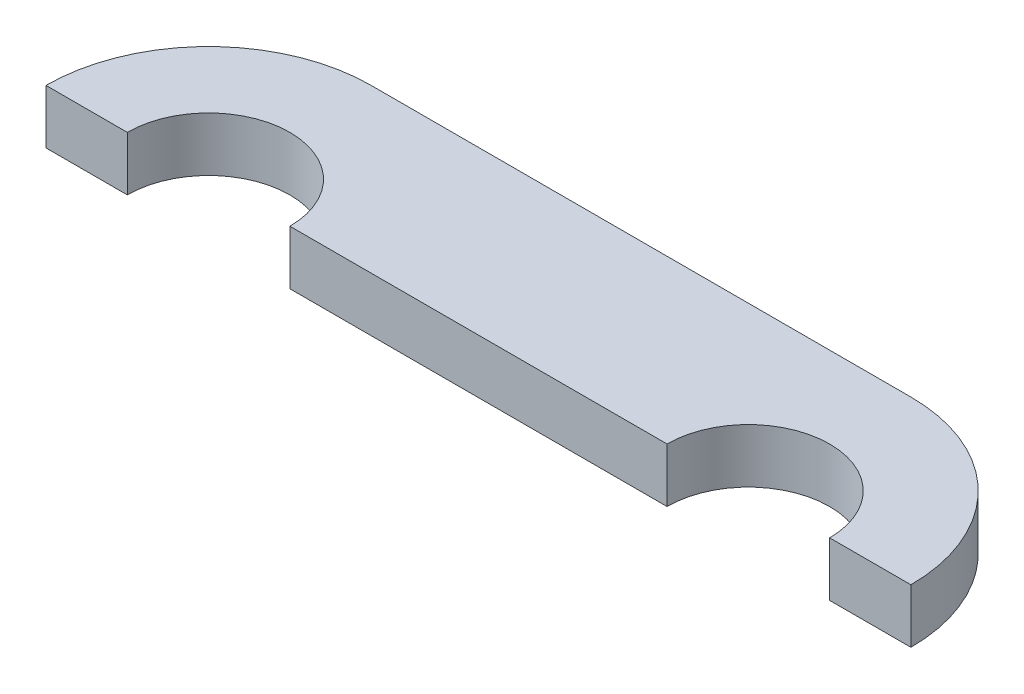
from build123d import *

# Parameters (mm, degrees)
SKETCH1_R               = 2.38125
BOSS_EXTRUDE1_DEPTH     = 1.5875
SKETCH2_R               = 3.175
BOSS_EXTRUDE2_DEPTH     = 1.5875
SKETCH3_R               = 2.38125
BOSS_EXTRUDE3_DEPTH     = 19.05
SKETCH4_R               = 3.175
BOSS_EXTRUDE4_DEPTH     = 1.5875
SKETCH5_R               = 2.38125
BOSS_EXTRUDE5_DEPTH     = 1.5875
SKETCH6_R               = 2.38125
CUT_EXTRUDE1_DEPTH      = 28.662025878
SKETCH7_W               = 40.69090725
SKETCH7_H               = 20.005301762
CUT_EXTRUDE2_DEPTH      = 26.381492779
CUT_EXTRUDE3_DEPTH      = 19.487872394
CUT_EXTRUDE3_DEPTH_BACK = 19.487872394
SKETCH8_R               = 2.38125


with BuildPart() as part:
    # Sketch1 → Boss-Extrude1 (new body)
    with BuildSketch(Plane(origin=(0, 0, 0), x_dir=(1, 0, 0), z_dir=(0, 1, 0))):
        with BuildLine():
            Line((9.398005644, 4.762076723), (-6.35, 4.7625))
            ThreePointArc((-6.35, 4.7625), (-11.020584629, 0.931152767), (-8.176363381, -4.398386414))
            ThreePointArc((-8.176363381, -4.398386414), (-5.292234705, -6.221263486), (-3.181508348, -8.901918869))
            ThreePointArc((-3.181508348, -8.901918869), (1.849687492, -11.693035316), (6.504625866, -8.311495529))
            ThreePointArc((6.504625866, -8.311495529), (8.146827792, -5.96033805), (10.67447942, -4.60544104))
            ThreePointArc((10.67447942, -4.60544104), (14.180390361, 0.643024113), (9.398005644, 4.762076723))
        make_face()
        with Locations(Location((-6.35, 0, 0), (0, 0, 270))):
            Circle(SKETCH1_R, mode=Mode.SUBTRACT)
        with Locations(Location((9.4615, 0, 0), (0, 0, 270))):
            Circle(SKETCH1_R, mode=Mode.SUBTRACT)
        with Locations(Location((1.524, -6.35, 0), (0, 0, 270))):
            Circle(SKETCH1_R, mode=Mode.SUBTRACT)
    extrude(amount=BOSS_EXTRUDE1_DEPTH)

    # Sketch2 → Boss-Extrude2 (add)
    with BuildSketch(Plane.XZ):
        with Locations(Location((1.524, 6.35, 0), (0, 0, 90))):
            Circle(SKETCH2_R)
    extrude(amount=BOSS_EXTRUDE2_DEPTH)

    # Sketch3 → Boss-Extrude3 (add)
    with BuildSketch(Plane(origin=(0, 0, 0), x_dir=(1, 0, 0), z_dir=(0, 1, 0))):
        with Locations(Location((1.524, -6.35, 0), (0, 0, 90))):
            Circle(SKETCH3_R)
    extrude(amount=BOSS_EXTRUDE3_DEPTH)

    # Sketch4 → Boss-Extrude4 (add)
    with BuildSketch(Plane(origin=(0, 19.05, 0), x_dir=(1, 0, 0), z_dir=(0, 1, 0))):
        with Locations(Location((1.524, -6.35, 0), (0, 0, 270))):
            Circle(SKETCH4_R)
    extrude(amount=-BOSS_EXTRUDE4_DEPTH)

    # Sketch6 → Cut-Extrude1 (cut, through all)
    with BuildSketch(Plane(origin=(0, 19.05, 0), x_dir=(1, 0, 0), z_dir=(0, 1, 0))):
        with Locations(Location((1.524, -6.35, 0), (0, 0, 90))):
            Circle(SKETCH6_R)
    extrude(amount=-CUT_EXTRUDE1_DEPTH, mode=Mode.SUBTRACT)


with BuildPart() as body_2:
    # Sketch5 → Boss-Extrude5 (new body)
    with BuildSketch(Plane.XZ.offset(-17.4625)):
        with BuildLine():
            ThreePointArc((-8.176363381, 4.398386414), (-11.020584629, -0.931152767), (-6.35, -4.7625))
            Line((-6.35, -4.7625), (9.4615, -4.7625))
            ThreePointArc((9.4615, -4.7625), (14.184572051, -0.611552653), (10.67447942, 4.60544104))
            ThreePointArc((10.67447942, 4.60544104), (8.146827792, 5.96033805), (6.504625866, 8.311495529))
            ThreePointArc((6.504625866, 8.311495529), (1.849687492, 11.693035316), (-3.181508348, 8.901918869))
            ThreePointArc((-3.181508348, 8.901918869), (-5.292234705, 6.221263486), (-8.176363381, 4.398386414))
        make_face()
        with Locations(Location((-6.35, 0, 0), (0, 0, 270))):
            Circle(SKETCH5_R, mode=Mode.SUBTRACT)
        with Locations(Location((9.4615, 0, 0), (0, 0, 270))):
            Circle(SKETCH5_R, mode=Mode.SUBTRACT)
        with Locations(Location((1.524, 6.35, 0), (0, 0, 270))):
            Circle(SKETCH5_R, mode=Mode.SUBTRACT)
    extrude(amount=BOSS_EXTRUDE5_DEPTH)


with BuildPart() as cut_extrude1_piece_1:
    # of the separate pieces the step leaves, piece 1, a body of its own (cut_extrude1_pieces)
    add(part.part.solids().sort_by_distance((9.398005644, 0, -4.762076723))[0])

    # Sketch7 → Cut-Extrude2 (cut, through all)
    with BuildSketch(Plane(origin=(0, 1.5875, 0), x_dir=(1, 0, 0), z_dir=(0, 1, 0))):
        with Locations((0.04887425, -4.128782639)):
            Rectangle(SKETCH7_W, SKETCH7_H)
    extrude(amount=-CUT_EXTRUDE2_DEPTH, mode=Mode.SUBTRACT)


with BuildPart() as cut_extrude1_piece_2:
    # of the separate pieces the step leaves, piece 2, a body of its own (cut_extrude1_pieces)
    add(part.part.solids().sort_by_distance((1.524, 17.4625, 9.525))[0])


with BuildPart() as cut_extrude3_tool:
    # Sketch8 → Cut-Extrude3 (new, two sides: drawn at the far end of the back side and taken through both)
    # profile 1 of 2: a face of its own
    with BuildSketch(Plane(origin=(0, 17.4625, 0), x_dir=(1, 0, 0), z_dir=(0, 1, 0)).offset(-CUT_EXTRUDE3_DEPTH_BACK)):
        with BuildLine():
            Line((14.224, 0), (11.84275, 0))
            ThreePointArc((11.84275, 0), (9.4615, -2.38125), (7.08025, 0))
            Line((7.08025, 0), (-3.96875, 0))
            ThreePointArc((-3.96875, 0), (-6.35, -2.38125), (-8.73125, 0))
            Line((-8.73125, 0), (-11.1125, 0))
            ThreePointArc((-11.1125, 0), (-10.311026499, -2.644177627), (-8.176363381, -4.398386414))
            ThreePointArc((-8.176363381, -4.398386414), (-5.292234705, -6.221263486), (-3.181508348, -8.901918869))
            ThreePointArc((-3.181508348, -8.901918869), (1.849687492, -11.693035316), (6.504625866, -8.311495529))
            ThreePointArc((6.504625866, -8.311495529), (8.146827792, -5.96033805), (10.67447942, -4.60544104))
            ThreePointArc((10.67447942, -4.60544104), (13.233649304, -2.907283248), (14.224, 0))
        make_face()
        with Locations((1.524, -6.35)):
            Circle(SKETCH8_R, mode=Mode.SUBTRACT)
    # profile 2 of 2: a face of its own
    with BuildSketch(Plane(origin=(0, 17.4625, 0), x_dir=(1, 0, 0), z_dir=(0, 1, 0)).offset(-CUT_EXTRUDE3_DEPTH_BACK)):
        with Locations((1.524, -6.35)):
            Circle(SKETCH8_R)
    extrude(amount=CUT_EXTRUDE3_DEPTH + CUT_EXTRUDE3_DEPTH_BACK)


with BuildPart() as body_2_1:
    add(body_2.part)

    # Cut-Extrude3: cut by cut_extrude3_tool
    add(cut_extrude3_tool.part, mode=Mode.SUBTRACT)


with BuildPart() as cut_extrude1_piece_2_1:
    add(cut_extrude1_piece_2.part)

    # Cut-Extrude3: cut by cut_extrude3_tool
    add(cut_extrude3_tool.part, mode=Mode.SUBTRACT)


solid = body_2_1.part
